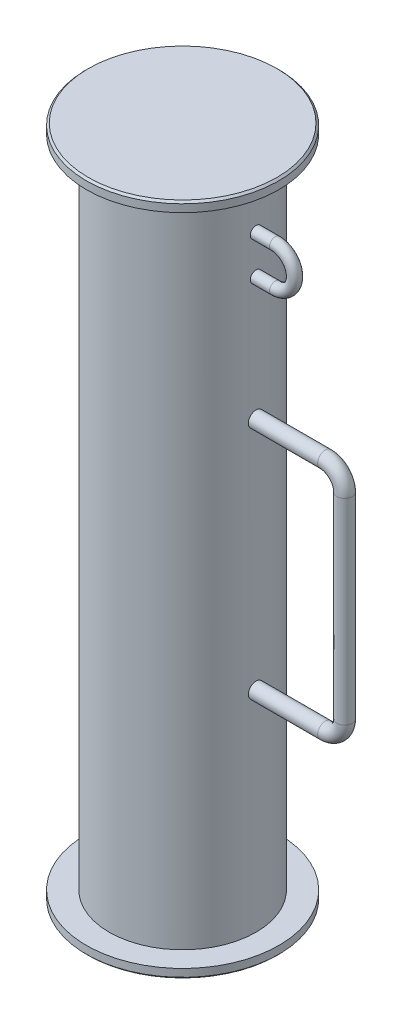
from build123d import *

# Parameters (mm, degrees)
SKETCH_1_R      = 50
EXTRUDE_1_DEPTH = 5
SKETCH_2_R      = 38.15
SKETCH_2_R_2    = 33.95
EXTRUDE_2_DEPTH = 340
SKETCH_3_R      = 50
EXTRUDE_3_DEPTH = 5
SKETCH_4_R      = 4
CHAMFER_1_SIZE  = 1
SKETCH_6_R      = 3


with BuildPart() as part:
    # Sketch 1 → 填料-伸長1 (new body)
    with BuildSketch(Plane(origin=(0, 0, 0), x_dir=(1, 0, 0), z_dir=(0, 1, 0))):
        with Locations(Location((0, 0, 0), (0, 0, 270))):
            Circle(SKETCH_1_R)
    extrude(amount=-EXTRUDE_1_DEPTH)

    # Sketch 2 → 填料-伸長2 (add)
    with BuildSketch(Plane.XZ.offset(5)):
        with Locations(Location((0, 0, 0), (0, 0, 90))):
            Circle(SKETCH_2_R)
        with Locations(Location((0, 0, 0), (0, 0, 270))):
            Circle(SKETCH_2_R_2, mode=Mode.SUBTRACT)
    extrude(amount=EXTRUDE_2_DEPTH)

    # 草圖3 → 填料-伸長3 (add)
    with BuildSketch(Plane.XZ.offset(345)):
        with Locations(Location((0, 0, 0), (0, 0, 90))):
            Circle(SKETCH_3_R)
    extrude(amount=EXTRUDE_3_DEPTH)

    # 導角1
    chamfer_1_edges = [part.edges().sort_by_distance(p)[0] for p in [
        (0, -350, -50),
        (0, 0, -50),
    ]]
    chamfer(chamfer_1_edges, length=CHAMFER_1_SIZE)


with BuildPart() as body_2:
    # 掃出1: sweep along a path in 草圖5
    with BuildLine(Plane.XY) as sweep_1_path:
        Line((38.15, -114), (74.15, -114))
        ThreePointArc((74.15, -114), (81.221067812, -116.928932188), (84.15, -124))
        Line((84.15, -124), (84.15, -226))
        ThreePointArc((84.15, -226), (81.221067812, -233.071067812), (74.15, -236))
        Line((74.15, -236), (38.15, -236))
    # 草圖4 → 掃出1 (sweep)
    with BuildSketch(Plane(origin=(38.15, 0, 0), x_dir=(0, 0, -1), z_dir=(1, 0, 0))):
        with Locations((0, -114)):
            Circle(SKETCH_4_R)
    sweep(path=sweep_1_path.line)


with BuildPart() as body_3:
    # 掃出2: sweep along a path in 草圖7
    with BuildLine(Plane.XY) as sweep_2_path:
        Line((38.15, -50), (48.15, -50))
        ThreePointArc((48.15, -50), (58.15, -40), (48.15, -30))
        Line((48.15, -30), (38.15, -30))
    # 草圖6 → 掃出2 (sweep)
    with BuildSketch(Plane(origin=(38.15, 0, 0), x_dir=(0, 0, -1), z_dir=(1, 0, 0))):
        with Locations((0, -50)):
            Circle(SKETCH_6_R)
    sweep(path=sweep_2_path.line)


solid = Compound([part.part, body_2.part, body_3.part])
